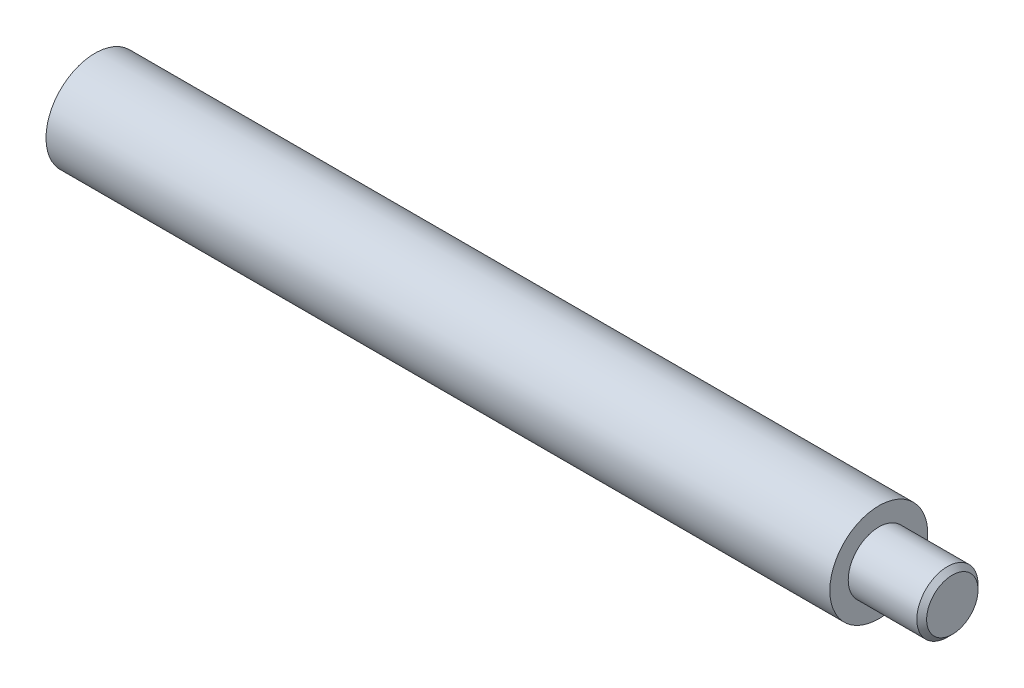
from build123d import *

# Parameters (mm, degrees)
M3_GEWINDEBOHRUNG1_D     = 2.5
M3_GEWINDEBOHRUNG1_DEPTH = 6.5
M3_GEWINDEBOHRUNG1_TIP   = 0.751075774
FASE1_SIZE               = 0.2


with BuildPart() as part:
    # Skizze1 → Rotation1 (revolve)
    with BuildSketch(Plane.XY, mode=Mode.PRIVATE) as rotation1_sk:
        Polygon((19, 0), (-16, 0), (-16, 2), (16, 2), (16, 1.25), (19, 1.25), align=None)
    revolve(rotation1_sk.sketch.rotate(Axis((0, 0, 0), (1, 0, 0)), 90), axis=Axis((0, 0, 0), (1, 0, 0)))

    # M3 Gewindebohrung1
    with Locations(Plane.ZY.offset(16)):
        with Locations((0, 0)):
            Hole(M3_GEWINDEBOHRUNG1_D / 2, depth=M3_GEWINDEBOHRUNG1_DEPTH)
            with Locations((0, 0, -(M3_GEWINDEBOHRUNG1_DEPTH + M3_GEWINDEBOHRUNG1_TIP / 2))):  # 118° drill point
                Cone(0, M3_GEWINDEBOHRUNG1_D / 2, M3_GEWINDEBOHRUNG1_TIP, mode=Mode.SUBTRACT)

    # Fase1
    fase1_edges = [part.edges().sort_by_distance(p)[0] for p in [
        (19, 0, -1.25),
    ]]
    chamfer(fase1_edges, length=FASE1_SIZE)


solid = part.part
